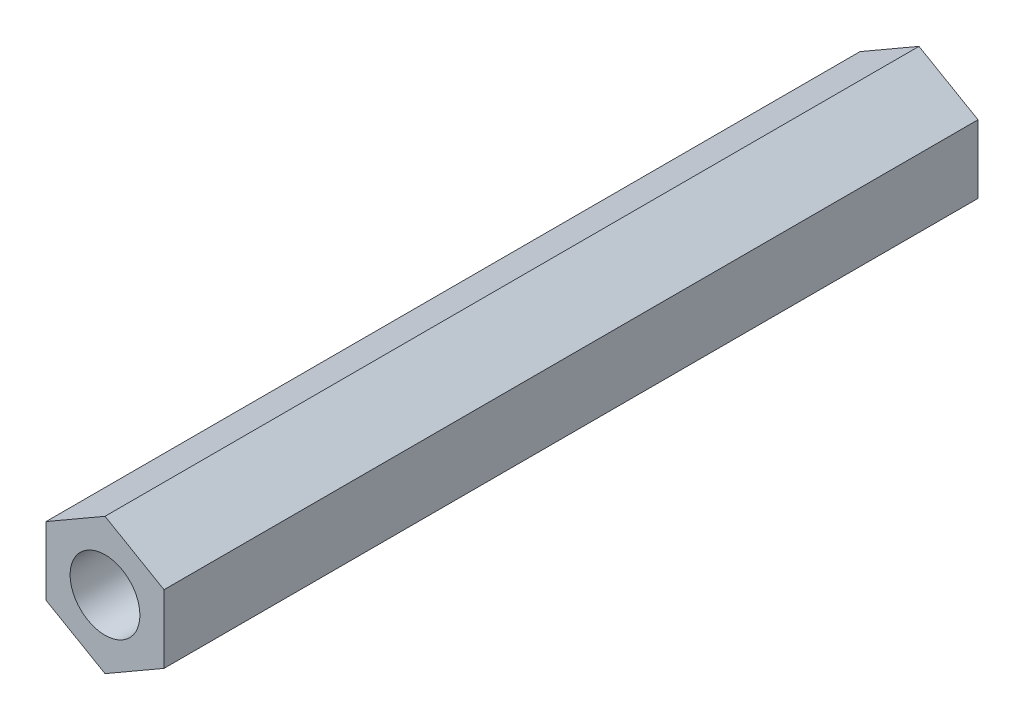
from build123d import *

# Parameters (mm, degrees)
ESQUISSE1_R        = 1.5
BOSS_EXTRU_1_DEPTH = 35


with BuildPart() as part:
    # Esquisse1 → Boss.-Extru.1 (new body)
    with BuildSketch(Plane.XY):
        Polygon((2.537454433, -1.465), (2.537454433, 1.465), (0, 2.93), (-2.537454433, 1.465), (-2.537454433, -1.465), (0, -2.93), align=None)
        Circle(ESQUISSE1_R, mode=Mode.SUBTRACT)
    extrude(amount=BOSS_EXTRU_1_DEPTH)


solid = part.part
